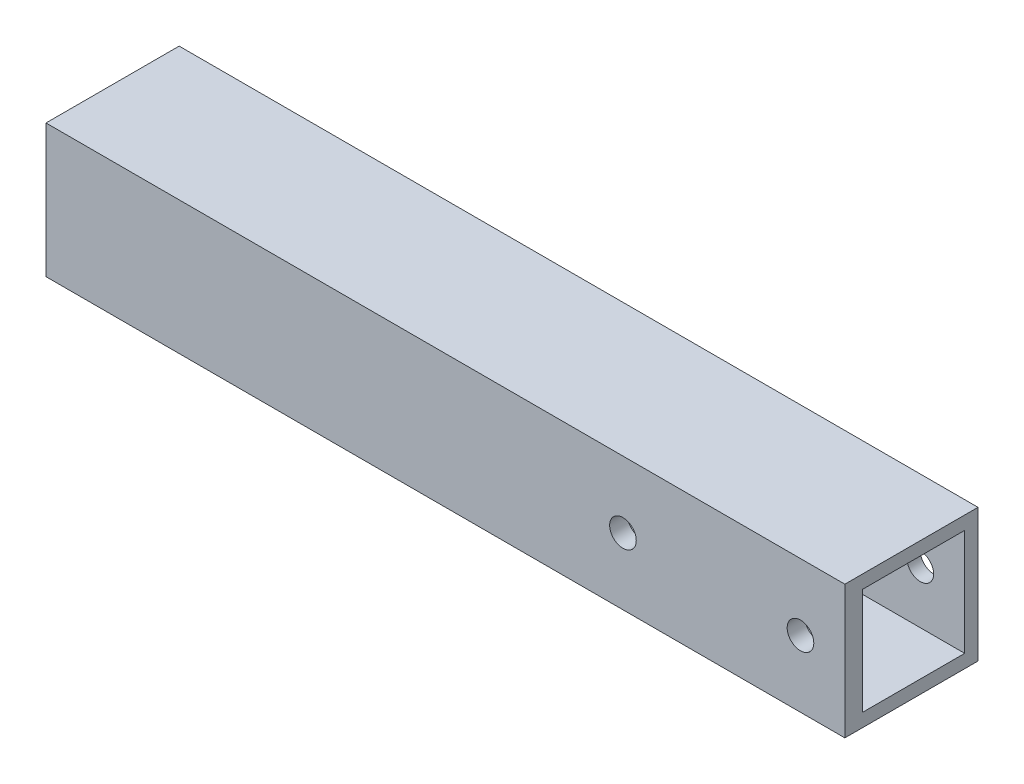
from build123d import *

# Parameters (mm, degrees)
MEMBER_15_15_1_5_1_DEPTH = 90
SKETCH_3_R               = 1.5
CUT_EXTRUDE_1_DEPTH      = 92.549167118


with BuildPart() as part:
    # Sketch1 → Member 15 _15_ 1.5_1 (new body)
    with BuildSketch(Plane(origin=(0, 0, 0), x_dir=(0, 0, -1), z_dir=(1, 0, 0))):
        Polygon((-6, -7.5), (6, -7.5), (7.5, -7.5), (7.5, -6), (7.5, 6), (7.5, 7.5), (6, 7.5), (-6, 7.5), (-7.5, 7.5), (-7.5, 6), (-7.5, -6), (-7.5, -7.5), align=None)
        Polygon((-4, -6), (4, -6), (6, -6), (6, -3.5), (6, 3.5), (6, 6), (3.5, 6), (-3.5, 6), (-5.5, 6), (-5.5, 3.5), (-5.5, -3.5), (-5.5, -6), align=None, mode=Mode.SUBTRACT)
    extrude(amount=MEMBER_15_15_1_5_1_DEPTH)

    # 草图3 → 切除-拉伸1 (cut, through all)
    with BuildSketch(Plane.XY.offset(7.5)):
        with Locations((85, 0)):
            Circle(SKETCH_3_R)
        with Locations((65, 0)):
            Circle(SKETCH_3_R)
    extrude(amount=-CUT_EXTRUDE_1_DEPTH, mode=Mode.SUBTRACT)


solid = part.part
